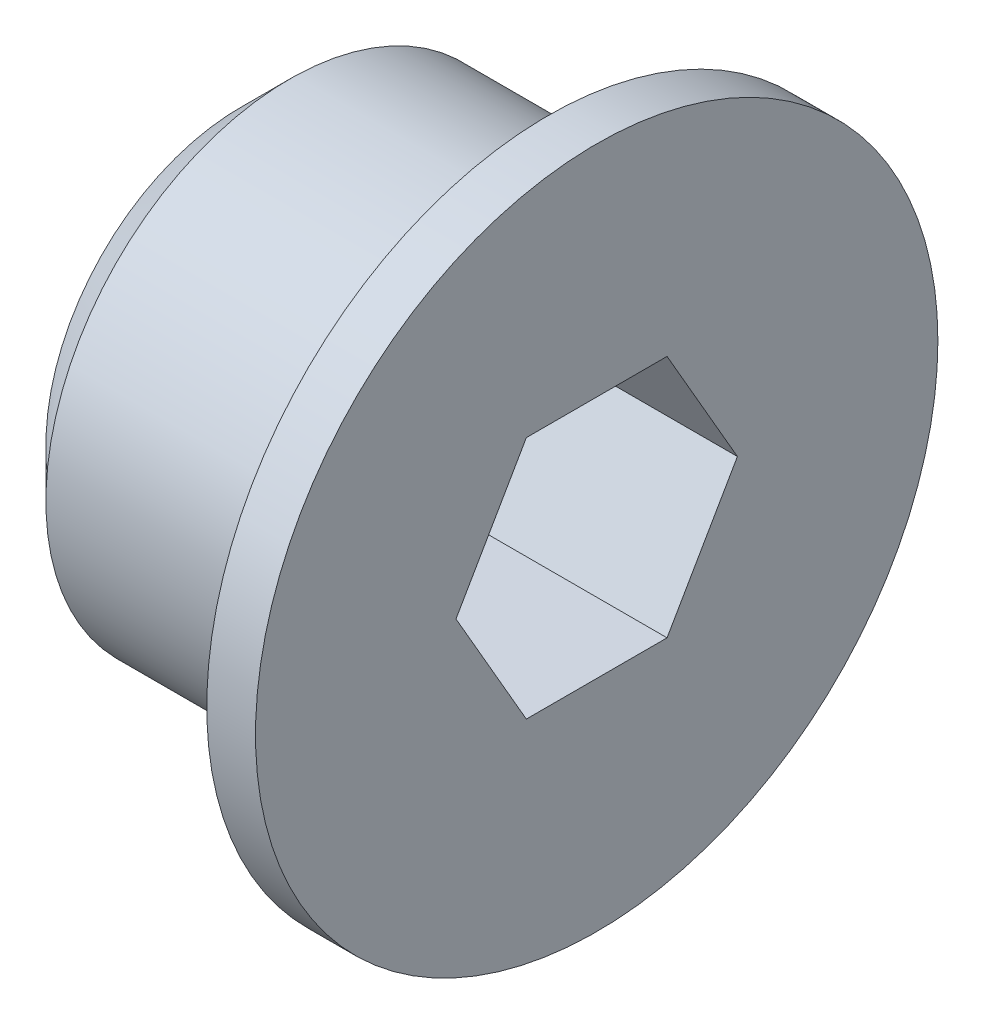
from build123d import *

# Parameters (mm, degrees)
SKETCH_1_R      = 5
EXTRUDE_1_DEPTH = 6.3
SKETCH_2_R      = 7
EXTRUDE_2_DEPTH = 1
CHAMFER_1_SIZE  = 1


with BuildPart() as part:
    # 草图1 → 凸台-拉伸1 (new body)
    with BuildSketch(Plane(origin=(0, 0, 0), x_dir=(0, 0, -1), z_dir=(1, 0, 0))):
        Circle(SKETCH_1_R)
        Polygon((2.886751346, 0), (1.443375673, 2.5), (-1.443375673, 2.5), (-2.886751346, 0), (-1.443375673, -2.5), (1.443375673, -2.5), align=None, mode=Mode.SUBTRACT)
    extrude(amount=EXTRUDE_1_DEPTH)

    # 草图2 → 凸台-拉伸2 (add)
    with BuildSketch(Plane(origin=(6.3, 0, 0), x_dir=(0, 0, -1), z_dir=(1, 0, 0))):
        Circle(SKETCH_2_R)
        Polygon((2.886751346, 0), (1.443375673, 2.5), (-1.443375673, 2.5), (-2.886751346, 0), (-1.443375673, -2.5), (1.443375673, -2.5), align=None, mode=Mode.SUBTRACT)
    extrude(amount=EXTRUDE_2_DEPTH)

    # 倒角1
    chamfer_1_edges = [part.edges().sort_by_distance(p)[0] for p in [
        (0, 0, 5),
    ]]
    chamfer(chamfer_1_edges, length=CHAMFER_1_SIZE)


solid = part.part
